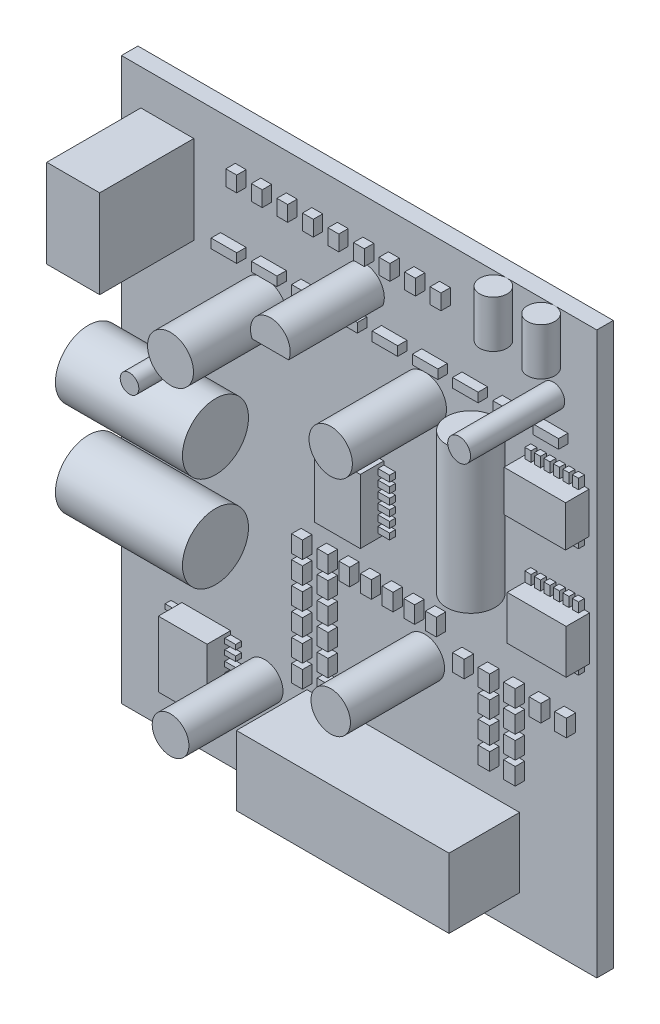
from build123d import *

# Parameters (mm, degrees)
ESQUISSE1_W         = 40.4
ESQUISSE1_H         = 47.7
EXTRUSION1_DEPTH    = 1.4
ESQUISSE2_W         = 4.5
ESQUISSE2_H         = 7.5
EXTRUSION2_DEPTH    = 8
ESQUISSE3_R         = 0.79186167
ESQUISSE3_R_2       = 1.951880722
ESQUISSE3_R_3       = 1.842468828
ESQUISSE3_R_4       = 1.558954638
ESQUISSE3_R_5       = 1.67657119
ESQUISSE3_R_6       = 0.970942625
EXTRUSION3_DEPTH    = 8
ESQUISSE4_W         = 18.067837798
ESQUISSE4_H         = 5.908978399
EXTRUSION4_DEPTH    = 6
ESQUISSE5_R         = 2.058287366
EXTRUSION5_DEPTH    = 12
ESQUISSE6_W         = 5.237550119
ESQUISSE6_H         = 3.485308217
ESQUISSE6_W_2       = 5.013789149
ESQUISSE6_H_2       = 3.748350347
ESQUISSE6_W_3       = 3.879871412
ESQUISSE6_H_3       = 5.458124189
ESQUISSE6_W_4       = 4.142913541
ESQUISSE6_H_4       = 5.589645254
EXTRUSION6_DEPTH    = 2
ESQUISSE7_W         = 0.526084259
ESQUISSE7_H         = 0.854886921
ESQUISSE7_W_2       = 0.52608426
ESQUISSE7_H_2       = 0.854886922
ESQUISSE7_H_3       = 0.825324501
ESQUISSE7_H_4       = 0.825324502
ESQUISSE7_W_3       = 0.987013361
ESQUISSE7_H_5       = 0.518042019
ESQUISSE7_H_6       = 0.518042018
ESQUISSE7_W_4       = 0.925850193
ESQUISSE7_H_7       = 0.409784135
ESQUISSE7_H_8       = 0.409784136
EXTRUSION7_DEPTH    = 0.5
ESQUISSE8_W         = 0.920647453
ESQUISSE8_H         = 1.315210648
ESQUISSE8_W_2       = 0.920647454
ESQUISSE8_W_3       = 2.170097569
ESQUISSE8_H_2       = 0.789126389
ESQUISSE8_W_4       = 2.17009757
ESQUISSE8_H_3       = 1.446731713
ESQUISSE8_W_5       = 0.986407986
EXTRUSION8_DEPTH    = 0.8
ESQUISSE9_R         = 2.806796007
EXTRUSION9_DEPTH    = 10.8
EXTRUSION9_2_DEPTH  = 10.8
ESQUISSE10_R        = 1.1611555
EXTRUSION10_DEPTH   = 4
EXTRUSION10_2_DEPTH = 4


with BuildPart() as part:
    # Esquisse1 → Extrusion1 (new body)
    with BuildSketch(Plane.XY):
        with Locations((20.2, 23.85)):
            Rectangle(ESQUISSE1_W, ESQUISSE1_H)
    extrude(amount=EXTRUSION1_DEPTH)

    # Esquisse2 → Extrusion2 (add)
    with BuildSketch(Plane.XY.offset(1.4)):
        with Locations((3.899833625, 40.916507811)):
            Rectangle(ESQUISSE2_W, ESQUISSE2_H)
    extrude(amount=EXTRUSION2_DEPTH)

    # Esquisse3 → Extrusion3 (add)
    with BuildSketch(Plane.XY.offset(1.4)):
        with Locations(Location((8.686210592, 31.905665219, 0), (0, 0, 180))):
            Circle(ESQUISSE3_R)
        with Locations(Location((12.171518809, 35.456733969, 0), (0, 0, 180))):
            Circle(ESQUISSE3_R_2)
        with Locations(Location((25.783949016, 35.456733969, 0), (0, 0, 180))):
            Circle(ESQUISSE3_R_3)
        with Locations(Location((12.171518809, 7.770760702, 0), (0, 0, 180))):
            Circle(ESQUISSE3_R_4)
        with Locations(Location((25.783949016, 16.32041904, 0), (0, 0, 180))):
            Circle(ESQUISSE3_R_5)
        with Locations(Location((36.700197394, 41.046379223, 0), (0, 0, 180))):
            Circle(ESQUISSE3_R_6)
        with BuildLine():
            Line((19.098712376, 40.398081259), (22.210542601, 40.398081259))
            ThreePointArc((22.210542601, 40.398081259), (20.654627489, 42.731953928), (19.098712376, 40.398081259))
        make_face()
    extrude(amount=EXTRUSION3_DEPTH)

    # Esquisse4 → Extrusion4 (add)
    with BuildSketch(Plane.XY.offset(1.4)):
        with Locations((24.805317175, 5.952613502)):
            Rectangle(ESQUISSE4_W, ESQUISSE4_H)
    extrude(amount=EXTRUSION4_DEPTH)

    # Esquisse6 → Extrusion6 (add)
    with BuildSketch(Plane.XY.offset(1.4)):
        with Locations((37.127483289, 33.911361458)):
            Rectangle(ESQUISSE6_W, ESQUISSE6_H)
        with Locations((37.29039021, 24.704886922)):
            Rectangle(ESQUISSE6_W_2, ESQUISSE6_H_2)
        with Locations((20.358705093, 26.283139699)):
            Rectangle(ESQUISSE6_W_3, ESQUISSE6_H_3)
        with Locations((7.206598613, 7.212585303)):
            Rectangle(ESQUISSE6_W_4, ESQUISSE6_H_4)
    extrude(amount=EXTRUSION6_DEPTH)

    # Esquisse7 → Extrusion7 (add)
    with BuildSketch(Plane.XY.offset(1.4)):
        with Locations((35.046537765, 36.081459026)):
            Rectangle(ESQUISSE7_W, ESQUISSE7_H)
        with Locations((35.853616865, 36.081459026)):
            Rectangle(ESQUISSE7_W_2, ESQUISSE7_H)
        with Locations((36.660695966, 36.081459026)):
            Rectangle(ESQUISSE7_W, ESQUISSE7_H)
        with Locations((37.467775067, 36.081459026)):
            Rectangle(ESQUISSE7_W, ESQUISSE7_H)
        with Locations((38.274854167, 36.081459026)):
            Rectangle(ESQUISSE7_W_2, ESQUISSE7_H)
        with Locations((39.081933268, 36.081459026)):
            Rectangle(ESQUISSE7_W, ESQUISSE7_H)
        with Locations((39.081933268, 31.741263888)):
            Rectangle(ESQUISSE7_W, ESQUISSE7_H_2)
        with Locations((38.274854167, 31.741263888)):
            Rectangle(ESQUISSE7_W_2, ESQUISSE7_H_2)
        with Locations((37.467775067, 31.741263888)):
            Rectangle(ESQUISSE7_W, ESQUISSE7_H_2)
        with Locations((36.660695966, 31.741263888)):
            Rectangle(ESQUISSE7_W, ESQUISSE7_H_2)
        with Locations((35.853616865, 31.741263888)):
            Rectangle(ESQUISSE7_W_2, ESQUISSE7_H_2)
        with Locations((35.046537765, 31.741263888)):
            Rectangle(ESQUISSE7_W, ESQUISSE7_H_2)
        with Locations((35.046537765, 26.991724346)):
            Rectangle(ESQUISSE7_W, ESQUISSE7_H_3)
        with Locations((35.853616865, 26.991724346)):
            Rectangle(ESQUISSE7_W_2, ESQUISSE7_H_3)
        with Locations((36.660695966, 26.991724346)):
            Rectangle(ESQUISSE7_W, ESQUISSE7_H_3)
        with Locations((37.467775067, 26.991724346)):
            Rectangle(ESQUISSE7_W, ESQUISSE7_H_3)
        with Locations((38.274854167, 26.991724346)):
            Rectangle(ESQUISSE7_W_2, ESQUISSE7_H_3)
        with Locations((39.081933268, 26.991724346)):
            Rectangle(ESQUISSE7_W, ESQUISSE7_H_3)
        with Locations((39.081933268, 22.418049497)):
            Rectangle(ESQUISSE7_W, ESQUISSE7_H_4)
        with Locations((38.274854167, 22.418049497)):
            Rectangle(ESQUISSE7_W_2, ESQUISSE7_H_4)
        with Locations((37.467775067, 22.418049497)):
            Rectangle(ESQUISSE7_W, ESQUISSE7_H_4)
        with Locations((36.660695966, 22.418049497)):
            Rectangle(ESQUISSE7_W, ESQUISSE7_H_4)
        with Locations((35.853616865, 22.418049497)):
            Rectangle(ESQUISSE7_W_2, ESQUISSE7_H_4)
        with Locations((35.046537765, 22.418049497)):
            Rectangle(ESQUISSE7_W, ESQUISSE7_H_4)
        with Locations((22.79214748, 28.440470634)):
            Rectangle(ESQUISSE7_W_3, ESQUISSE7_H_5)
        with Locations((22.79214748, 27.589401603)):
            Rectangle(ESQUISSE7_W_3, ESQUISSE7_H_5)
        with Locations((22.79214748, 26.738332572)):
            Rectangle(ESQUISSE7_W_3, ESQUISSE7_H_6)
        with Locations((22.79214748, 25.887263542)):
            Rectangle(ESQUISSE7_W_3, ESQUISSE7_H_5)
        with Locations((22.79214748, 25.036194511)):
            Rectangle(ESQUISSE7_W_3, ESQUISSE7_H_5)
        with Locations((22.79214748, 24.18512548)):
            Rectangle(ESQUISSE7_W_3, ESQUISSE7_H_5)
        with Locations((17.925262706, 24.18512548)):
            Rectangle(ESQUISSE7_W_3, ESQUISSE7_H_5)
        with Locations((17.925262706, 25.036194511)):
            Rectangle(ESQUISSE7_W_3, ESQUISSE7_H_5)
        with Locations((17.925262706, 25.887263542)):
            Rectangle(ESQUISSE7_W_3, ESQUISSE7_H_5)
        with Locations((17.925262706, 26.738332572)):
            Rectangle(ESQUISSE7_W_3, ESQUISSE7_H_6)
        with Locations((17.925262706, 27.589401603)):
            Rectangle(ESQUISSE7_W_3, ESQUISSE7_H_5)
        with Locations((17.925262706, 28.440470634)):
            Rectangle(ESQUISSE7_W_3, ESQUISSE7_H_5)
        with Locations((9.740980479, 9.496200378)):
            Rectangle(ESQUISSE7_W_4, ESQUISSE7_H_7)
        with Locations((9.740980479, 8.647361813)):
            Rectangle(ESQUISSE7_W_4, ESQUISSE7_H_8)
        with Locations((9.740980479, 7.798523248)):
            Rectangle(ESQUISSE7_W_4, ESQUISSE7_H_7)
        with Locations((9.740980479, 6.949684682)):
            Rectangle(ESQUISSE7_W_4, ESQUISSE7_H_7)
        with Locations((9.740980479, 6.100846116)):
            Rectangle(ESQUISSE7_W_4, ESQUISSE7_H_7)
        with Locations((9.740980479, 5.252007551)):
            Rectangle(ESQUISSE7_W_4, ESQUISSE7_H_7)
        with Locations((4.672216746, 5.252007551)):
            Rectangle(ESQUISSE7_W_4, ESQUISSE7_H_7)
        with Locations((4.672216746, 6.100846116)):
            Rectangle(ESQUISSE7_W_4, ESQUISSE7_H_7)
        with Locations((4.672216746, 6.949684682)):
            Rectangle(ESQUISSE7_W_4, ESQUISSE7_H_7)
        with Locations((4.672216746, 7.798523248)):
            Rectangle(ESQUISSE7_W_4, ESQUISSE7_H_7)
        with Locations((4.672216746, 8.647361813)):
            Rectangle(ESQUISSE7_W_4, ESQUISSE7_H_8)
        with Locations((4.672216746, 9.496200378)):
            Rectangle(ESQUISSE7_W_4, ESQUISSE7_H_7)
    extrude(amount=EXTRUSION7_DEPTH)

    # Esquisse8 → Extrusion8 (add)
    with BuildSketch(Plane.XY.offset(1.4)):
        with Locations((12.303039874, 43.939842648)):
            Rectangle(ESQUISSE8_W, ESQUISSE8_H)
        with Locations((10.132942305, 43.939842648)):
            Rectangle(ESQUISSE8_W, ESQUISSE8_H)
        with Locations((14.473137443, 43.939842648)):
            Rectangle(ESQUISSE8_W_2, ESQUISSE8_H)
        with Locations((16.643235012, 43.939842648)):
            Rectangle(ESQUISSE8_W_2, ESQUISSE8_H)
        with Locations((18.813332581, 43.939842648)):
            Rectangle(ESQUISSE8_W, ESQUISSE8_H)
        with Locations((20.983430151, 43.939842648)):
            Rectangle(ESQUISSE8_W, ESQUISSE8_H)
        with Locations((23.15352772, 43.939842648)):
            Rectangle(ESQUISSE8_W_2, ESQUISSE8_H)
        with Locations((25.323625289, 43.939842648)):
            Rectangle(ESQUISSE8_W_2, ESQUISSE8_H)
        with Locations((27.493722858, 43.939842648)):
            Rectangle(ESQUISSE8_W_2, ESQUISSE8_H)
        with Locations((12.927764932, 38.48171846)):
            Rectangle(ESQUISSE8_W_3, ESQUISSE8_H_2)
        with Locations((9.508217247, 38.48171846)):
            Rectangle(ESQUISSE8_W_3, ESQUISSE8_H_2)
        with Locations((16.347312617, 38.48171846)):
            Rectangle(ESQUISSE8_W_3, ESQUISSE8_H_2)
        with Locations((19.766860302, 38.48171846)):
            Rectangle(ESQUISSE8_W_3, ESQUISSE8_H_2)
        with Locations((23.186407986, 38.48171846)):
            Rectangle(ESQUISSE8_W_4, ESQUISSE8_H_2)
        with Locations((26.605955671, 38.48171846)):
            Rectangle(ESQUISSE8_W_3, ESQUISSE8_H_2)
        with Locations((30.025503355, 38.48171846)):
            Rectangle(ESQUISSE8_W_3, ESQUISSE8_H_2)
        with Locations((33.445051041, 38.48171846)):
            Rectangle(ESQUISSE8_W_3, ESQUISSE8_H_2)
        with Locations((36.864598726, 38.48171846)):
            Rectangle(ESQUISSE8_W_3, ESQUISSE8_H_2)
        with Locations((17.892685128, 17.898671818)):
            Rectangle(ESQUISSE8_W_2, ESQUISSE8_H_3)
        with Locations((15.722587558, 19.805727258)):
            Rectangle(ESQUISSE8_W, ESQUISSE8_H_3)
        with Locations((17.892685128, 19.805727258)):
            Rectangle(ESQUISSE8_W_2, ESQUISSE8_H_3)
        with Locations((15.722587558, 17.898671818)):
            Rectangle(ESQUISSE8_W, ESQUISSE8_H_3)
        with Locations((17.892685128, 15.991616379)):
            Rectangle(ESQUISSE8_W_2, ESQUISSE8_H_3)
        with Locations((15.722587558, 15.991616379)):
            Rectangle(ESQUISSE8_W, ESQUISSE8_H_3)
        with Locations((17.892685128, 14.084560939)):
            Rectangle(ESQUISSE8_W_2, ESQUISSE8_H_3)
        with Locations((15.722587558, 14.084560939)):
            Rectangle(ESQUISSE8_W, ESQUISSE8_H_3)
        with Locations((17.892685128, 12.177505499)):
            Rectangle(ESQUISSE8_W_2, ESQUISSE8_H_3)
        with Locations((15.722587558, 12.177505499)):
            Rectangle(ESQUISSE8_W, ESQUISSE8_H_3)
        with Locations((17.892685128, 10.270450059)):
            Rectangle(ESQUISSE8_W_2, ESQUISSE8_H_3)
        with Locations((15.722587558, 10.270450059)):
            Rectangle(ESQUISSE8_W, ESQUISSE8_H_3)
        with Locations((19.733980035, 19.805727258)):
            Rectangle(ESQUISSE8_W_2, ESQUISSE8_H_3)
        with Locations((21.575274942, 19.805727258)):
            Rectangle(ESQUISSE8_W_2, ESQUISSE8_H_3)
        with Locations((23.41656985, 19.805727258)):
            Rectangle(ESQUISSE8_W, ESQUISSE8_H_3)
        with Locations((25.257864757, 19.805727258)):
            Rectangle(ESQUISSE8_W, ESQUISSE8_H_3)
        with Locations((27.099159664, 19.805727258)):
            Rectangle(ESQUISSE8_W_2, ESQUISSE8_H_3)
        with Locations((31.603756133, 17.898671818)):
            Rectangle(ESQUISSE8_W_5, ESQUISSE8_H_3)
        with Locations((29.433658564, 17.898671818)):
            Rectangle(ESQUISSE8_W_5, ESQUISSE8_H_3)
        with Locations((33.773853703, 17.898671818)):
            Rectangle(ESQUISSE8_W_5, ESQUISSE8_H_3)
        with Locations((35.943951272, 17.898671818)):
            Rectangle(ESQUISSE8_W_5, ESQUISSE8_H_3)
        with Locations((38.114048841, 17.898671818)):
            Rectangle(ESQUISSE8_W_5, ESQUISSE8_H_3)
        with Locations((31.603756133, 15.991616379)):
            Rectangle(ESQUISSE8_W_5, ESQUISSE8_H_3)
        with Locations((31.603756133, 14.084560939)):
            Rectangle(ESQUISSE8_W_5, ESQUISSE8_H_3)
        with Locations((31.603756133, 12.177505499)):
            Rectangle(ESQUISSE8_W_5, ESQUISSE8_H_3)
        with Locations((33.773853703, 15.991616379)):
            Rectangle(ESQUISSE8_W_5, ESQUISSE8_H_3)
        with Locations((33.773853703, 14.084560939)):
            Rectangle(ESQUISSE8_W_5, ESQUISSE8_H_3)
        with Locations((33.773853703, 12.177505499)):
            Rectangle(ESQUISSE8_W_5, ESQUISSE8_H_3)
    extrude(amount=EXTRUSION8_DEPTH)


with BuildPart() as body_2:
    # Esquisse5 → Extrusion5 (new body)
    with BuildSketch(Plane(origin=(0, 25, 0), x_dir=(-1, 0, 0), z_dir=(0, 1, 0))):
        with Locations(Location((-31.747395334, 3.458287366, 0), (0, 0, 90))):
            Circle(ESQUISSE5_R)
    extrude(amount=EXTRUSION5_DEPTH)


with BuildPart() as body_3:
    # Esquisse9 → Extrusion9 (new body)
    with BuildSketch(Plane.ZY):
        with Locations((4.206796007, 26.44754103)):
            Circle(ESQUISSE9_R)
    extrude(amount=-EXTRUSION9_DEPTH)


with BuildPart() as body_4:
    # Esquisse9 → Extrusion9 2 (new body)
    with BuildSketch(Plane.ZY):
        with Locations((4.206796007, 18.358995545)):
            Circle(ESQUISSE9_R)
    extrude(amount=-EXTRUSION9_2_DEPTH)


with BuildPart() as body_5:
    # Esquisse10 → Extrusion10 (new body)
    with BuildSketch(Plane(origin=(0, 47.7, 0), x_dir=(-1, 0, 0), z_dir=(0, 1, 0))):
        with Locations(Location((-36.82755279, 2.5611555, 0), (0, 0, 90))):
            Circle(ESQUISSE10_R)
    extrude(amount=-EXTRUSION10_DEPTH)


with BuildPart() as body_6:
    # Esquisse10 → Extrusion10 2 (new body)
    with BuildSketch(Plane(origin=(0, 47.7, 0), x_dir=(-1, 0, 0), z_dir=(0, 1, 0))):
        with Locations(Location((-32.774325323, 2.5611555, 0), (0, 0, 90))):
            Circle(ESQUISSE10_R)
    extrude(amount=-EXTRUSION10_2_DEPTH)


solid = Compound([part.part, body_2.part, body_3.part, body_4.part, body_5.part, body_6.part])
